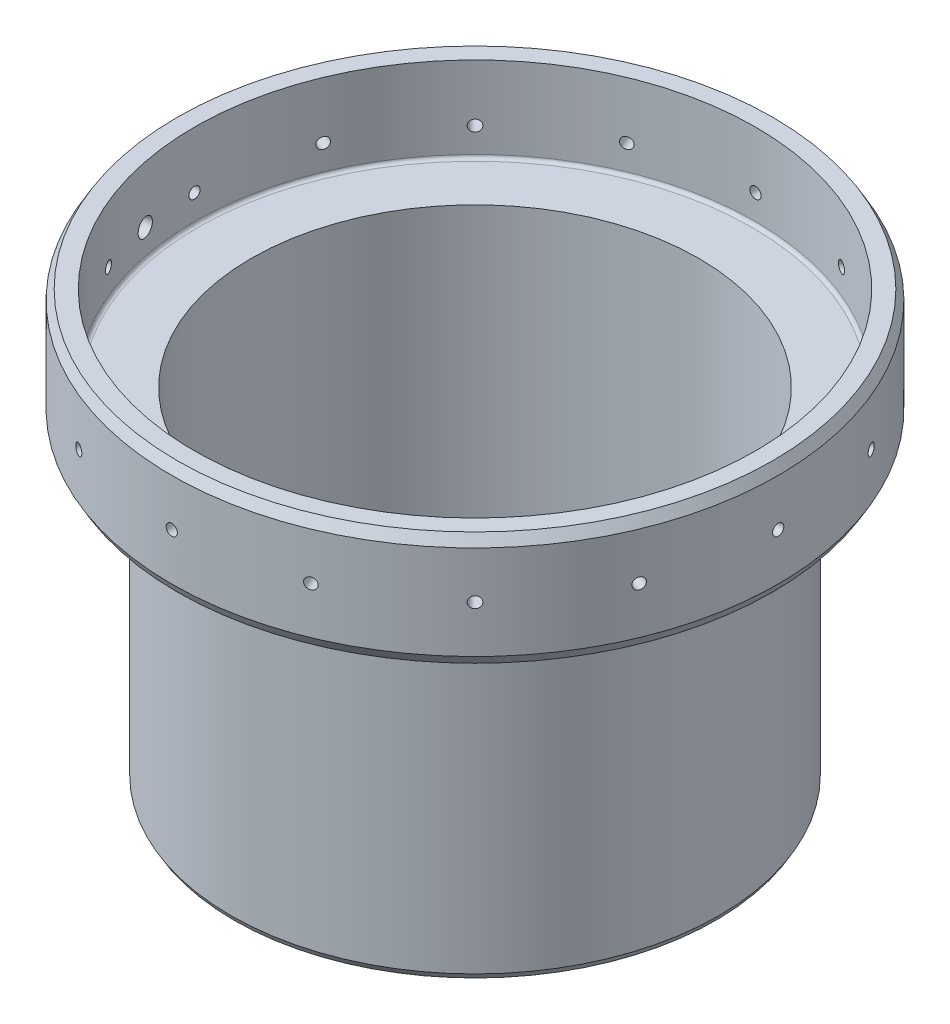
from build123d import *
from OCP.BRepFilletAPI import BRepFilletAPI_MakeChamfer

# Parameters (mm, degrees)
CIRPATTERN1_COUNT              = 16
TAP_DRILL_FOR_10_32_TAP1_D     = 4.0386
TAP_DRILL_FOR_10_32_TAP1_DEPTH = 10.16
TAP_DRILL_FOR_10_32_TAP1_TIP   = 1.213317848
CIRPATTERN2_COUNT              = 16
CHAMFER2_SIZE                  = 1.27
CHAMFER2_SIZE2                 = 2.199704526
CHAMFER4_SIZE                  = 0.762
CHAMFER4_SIZE2                 = 1.319822715
CHAMFER5_SIZE                  = 0.762
CHAMFER5_SIZE2                 = 1.319822715
FILLET1_R                      = 0.762


with BuildPart() as part:
    # Sketch1 → Revolve6 (revolve)
    with BuildSketch(Plane.XY, mode=Mode.PRIVATE) as revolve6_sk:
        Polygon((-62.6618, 0), (-67.7418, 0), (-67.7418, -25.4), (-54.5465, -25.4), (-54.5465, -95.25), (-49.9745, -95.25), (-49.9745, -19.05), (-62.6618, -19.05), align=None)
    revolve(revolve6_sk.sketch.rotate(Axis((0, 0, 0), (0, 1, 0)), 270), axis=Axis((0, 0, 0), (0, 1, 0)))

    # Sketch4 → Tap Drill for M3x0.5 Tap1 (revolve, cut)
    with BuildSketch(Plane(origin=(-67.7418, -12.7, 0), x_dir=(0, 0, 1), z_dir=(0, 1, 0))):
        Polygon((0, 0), (0, 10.911075774), (1.25, 10.16), (1.25, 0), align=None)
    tap_drill_for_m3x0_5_tap1 = revolve(axis=Axis((-74.0918, -12.7, 0), (1, 0, 0)), mode=Mode.SUBTRACT)

    # CirPattern1: Tap Drill for M3x0.5 Tap1 ×16 about axis
    cirpattern1_axis = Axis((0, 0, 0), (0, -1, 0))
    for i in range(1, CIRPATTERN1_COUNT):
        add(tap_drill_for_m3x0_5_tap1.rotate(cirpattern1_axis, i * 360 / CIRPATTERN1_COUNT), mode=Mode.SUBTRACT)

    # Tap Drill for #10-32 Tap1
    with Locations(Plane(origin=(-66.440160308, 0, 13.215769576), x_dir=(0.19509032201612886, 0, 0.9807852804032304), z_dir=(-0.9807852804032304, 0, 0.19509032201612886))):
        with Locations((0, -12.7)):
            Hole(TAP_DRILL_FOR_10_32_TAP1_D / 2, depth=TAP_DRILL_FOR_10_32_TAP1_DEPTH)
            with Locations((0, 0, -(TAP_DRILL_FOR_10_32_TAP1_DEPTH + TAP_DRILL_FOR_10_32_TAP1_TIP / 2))):  # 118° drill point
                Cone(0, TAP_DRILL_FOR_10_32_TAP1_D / 2, TAP_DRILL_FOR_10_32_TAP1_TIP, mode=Mode.SUBTRACT)

    # Sketch10 → Tap Drill for #4-40 Tap1 (revolve, cut)
    with BuildSketch(Plane(origin=(52.2605, -95.25, 0), x_dir=(0, 0, -1), z_dir=(1, 0, 0))):
        Polygon((0, 0), (0, 18.459152758), (1.1303, 17.78), (1.1303, 0), align=None)
    tap_drill_for_4_40_tap1 = revolve(axis=Axis((52.2605, -101.6, 0), (0, 1, 0)), mode=Mode.SUBTRACT)

    # CirPattern2: Tap Drill for #4-40 Tap1 ×16 about axis
    cirpattern2_axis = Axis((0, 0, 0), (0, 1, 0))
    for i in range(1, CIRPATTERN2_COUNT):
        add(tap_drill_for_4_40_tap1.rotate(cirpattern2_axis, i * 360 / CIRPATTERN2_COUNT), mode=Mode.SUBTRACT)

    # Chamfer2: one chamfer whose edges measure the first distance from different faces: ONE call of the kernel's chamfer builder (chamfer() names one face for all edges)
    chamfer2_edges_1 = [part.edges().sort_by_distance(p)[0] for p in [
        (0, -25.4, 67.7418),
    ]]
    chamfer2_side_1 = [part.faces().sort_by_distance(p)[0] for p in [
        (0, -25.4, 65.825772554),
    ]]
    chamfer2_edges_2 = [part.edges().sort_by_distance(p)[0] for p in [
        (0, 0, 67.7418),
    ]]
    chamfer2_side_2 = [part.faces().sort_by_distance(p)[0] for p in [
        (0, 0, 64.577827446),
    ]]
    chamfer2 = BRepFilletAPI_MakeChamfer(part.part.solid().wrapped)
    for e in chamfer2_edges_1:
        chamfer2.Add(CHAMFER2_SIZE, CHAMFER2_SIZE2, e.wrapped, chamfer2_side_1[0].wrapped)  # the first distance lies on this face
    for e in chamfer2_edges_2:
        chamfer2.Add(CHAMFER2_SIZE, CHAMFER2_SIZE2, e.wrapped, chamfer2_side_2[0].wrapped)  # the first distance lies on this face
    add(Compound.cast(chamfer2.Shape()), mode=Mode.REPLACE)

    # Chamfer4
    chamfer4_edges = [part.edges().sort_by_distance(p)[0] for p in [
        (0, -95.25, 54.5465),
    ]]
    chamfer4_side = [part.faces().sort_by_distance(p)[0] for p in [
        (0, -95.25, 54.3922192),
    ]]
    chamfer(chamfer4_edges, length=CHAMFER4_SIZE, length2=CHAMFER4_SIZE2, reference=chamfer4_side[0])

    # Chamfer5
    chamfer5_edges = [part.edges().sort_by_distance(p)[0] for p in [
        (0, -95.25, 49.9745),
    ]]
    chamfer5_side = [part.faces().sort_by_distance(p)[0] for p in [
        (0, -95.25, 53.632374461),
    ]]
    chamfer(chamfer5_edges, length=CHAMFER5_SIZE, length2=CHAMFER5_SIZE2, reference=chamfer5_side[0])

    # Fillet1
    fillet1_edges = [part.edges().sort_by_distance(p)[0] for p in [
        (0, -19.05, 62.6618),
        (0, -25.4, 54.5465),
    ]]
    fillet(fillet1_edges, radius=FILLET1_R)


solid = part.part
